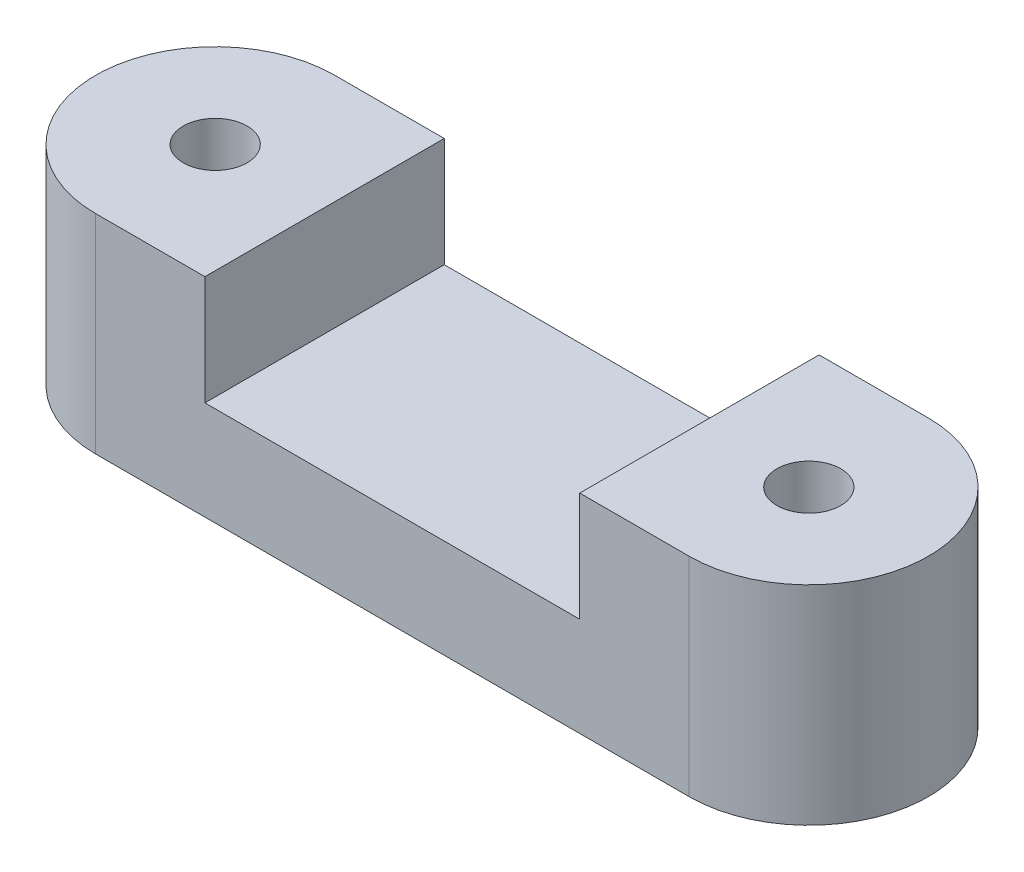
from build123d import *

# Parameters (mm, degrees)
SKETCH1_R           = 1.4605
BOSS_EXTRUDE1_DEPTH = 9.525
SKETCH2_W           = 17.145
SKETCH2_H           = 10.9474
CUT_EXTRUDE1_DEPTH  = 5


with BuildPart() as part:
    # Sketch1 → Boss-Extrude1 (new body)
    with BuildSketch(Plane(origin=(0, 0, 0), x_dir=(1, 0, 0), z_dir=(0, 1, 0))):
        with BuildLine():
            Line((0, 5.4737), (27.1526, 5.4737))
            ThreePointArc((27.1526, 5.4737), (32.6263, 0), (27.1526, -5.4737))
            Line((27.1526, -5.4737), (0, -5.4737))
            ThreePointArc((0, -5.4737), (-5.4737, 0), (0, 5.4737))
        make_face()
        with Locations(Location((0, 0, 0), (0, 0, 90))):
            Circle(SKETCH1_R, mode=Mode.SUBTRACT)
        with Locations(Location((27.1526, 0, 0), (0, 0, 90))):
            Circle(SKETCH1_R, mode=Mode.SUBTRACT)
    extrude(amount=BOSS_EXTRUDE1_DEPTH)

    # Sketch2 → Cut-Extrude1 (cut)
    with BuildSketch(Plane(origin=(0, 9.525, 0), x_dir=(1, 0, 0), z_dir=(0, 1, 0))):
        with Locations((13.5763, 0)):
            Rectangle(SKETCH2_W, SKETCH2_H)
    extrude(amount=-CUT_EXTRUDE1_DEPTH, mode=Mode.SUBTRACT)


solid = part.part
